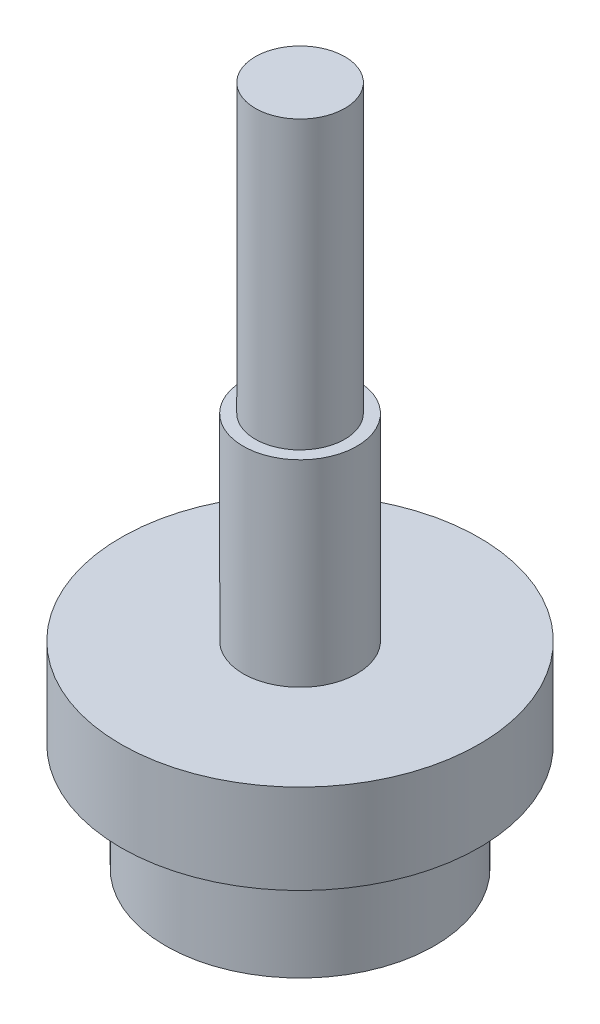
from build123d import *

# Parameters (mm, degrees)
SKETCH_1_R               = 2.5
EXTRUDE_1_DEPTH          = 4
SKETCH_3_R               = 7.5
EXTRUDE_3_DEPTH          = 6
SKETCH_4_R               = 10
EXTRUDE_4_DEPTH          = 5
SKETCH_5_R               = 3.175
EXTRUDE_5_DEPTH          = 11
SKETCH_6_R               = 10
EXTRUDE_6_DEPTH          = 5
SKETCH_7_R               = 7.5
EXTRUDE_7_DEPTH          = 7
SKETCH_8_R               = 2.5
EXTRUDE_8_DEPTH          = 4
CUT_EXTRUDE_1_DEPTH      = 45.317039612
CUT_EXTRUDE_1_DEPTH_BACK = 1
SKETCH_10_R              = 2.5
SKETCH_13_R              = 10
SKETCH_13_R_2            = 2.5
CUT_EXTRUDE_3_DEPTH      = 15


with BuildPart() as part:
    # 草图1 → 凸台-拉伸1 (new body)
    with BuildSketch(Plane(origin=(0, 0, 0), x_dir=(1, 0, 0), z_dir=(0, 1, 0))):
        with Locations(Location((0, 0, 0), (0, 0, 270))):
            Circle(SKETCH_1_R)
    extrude(amount=EXTRUDE_1_DEPTH)

    # 草图3 → 凸台-拉伸3 (add)
    with BuildSketch(Plane(origin=(0, 4, 0), x_dir=(1, 0, 0), z_dir=(0, 1, 0))):
        with Locations(Location((0, 0, 0), (0, 0, 270))):
            Circle(SKETCH_3_R)
    extrude(amount=EXTRUDE_3_DEPTH)

    # 草图4 → 凸台-拉伸4 (add)
    with BuildSketch(Plane(origin=(0, 10, 0), x_dir=(1, 0, 0), z_dir=(0, 1, 0))):
        with Locations(Location((0, 0, 0), (0, 0, 270))):
            Circle(SKETCH_4_R)
    extrude(amount=EXTRUDE_4_DEPTH)

    # 草图5 → 凸台-拉伸5 (add)
    with BuildSketch(Plane(origin=(0, 15, 0), x_dir=(1, 0, 0), z_dir=(0, 1, 0))):
        with Locations(Location((0, 0, 0), (0, 0, 270))):
            Circle(SKETCH_5_R)
    extrude(amount=EXTRUDE_5_DEPTH)

    # 草图6 → 凸台-拉伸6 (add)
    with BuildSketch(Plane(origin=(0, 26, 0), x_dir=(1, 0, 0), z_dir=(0, 1, 0))):
        with Locations(Location((0, 0, 0), (0, 0, 270))):
            Circle(SKETCH_6_R)
    extrude(amount=EXTRUDE_6_DEPTH)

    # 草图7 → 凸台-拉伸7 (add)
    with BuildSketch(Plane(origin=(0, 31, 0), x_dir=(1, 0, 0), z_dir=(0, 1, 0))):
        with Locations(Location((0, 0, 0), (0, 0, 270))):
            Circle(SKETCH_7_R)
    extrude(amount=EXTRUDE_7_DEPTH)

    # 草图8 → 凸台-拉伸8 (add)
    with BuildSketch(Plane(origin=(0, 38, 0), x_dir=(1, 0, 0), z_dir=(0, 1, 0))):
        with Locations(Location((0, 0, 0), (0, 0, 270))):
            Circle(SKETCH_8_R)
    extrude(amount=EXTRUDE_8_DEPTH)

    # 草图10 → 切除-拉伸1 (cut, two sides: drawn at the far end of the back side and taken through both)
    with BuildSketch(Plane(origin=(0, 0, 0), x_dir=(-1, 0, 0), z_dir=(0, -1, 0)).offset(-CUT_EXTRUDE_1_DEPTH_BACK)):
        with Locations(Location((0, 0, 0), (0, 0, 90))):
            Circle(SKETCH_10_R)
    extrude(amount=CUT_EXTRUDE_1_DEPTH + CUT_EXTRUDE_1_DEPTH_BACK, mode=Mode.SUBTRACT)

    # 草图13 → 切除-拉伸3 (cut)
    with BuildSketch(Plane.XZ.offset(-26)):
        with Locations(Location((0, 0, 0), (0, 0, 90))):
            Circle(SKETCH_13_R)
        with Locations(Location((0, 0, 0), (0, 0, 270))):
            Circle(SKETCH_13_R_2, mode=Mode.SUBTRACT)
    extrude(amount=-CUT_EXTRUDE_3_DEPTH, mode=Mode.SUBTRACT)


solid = part.part
